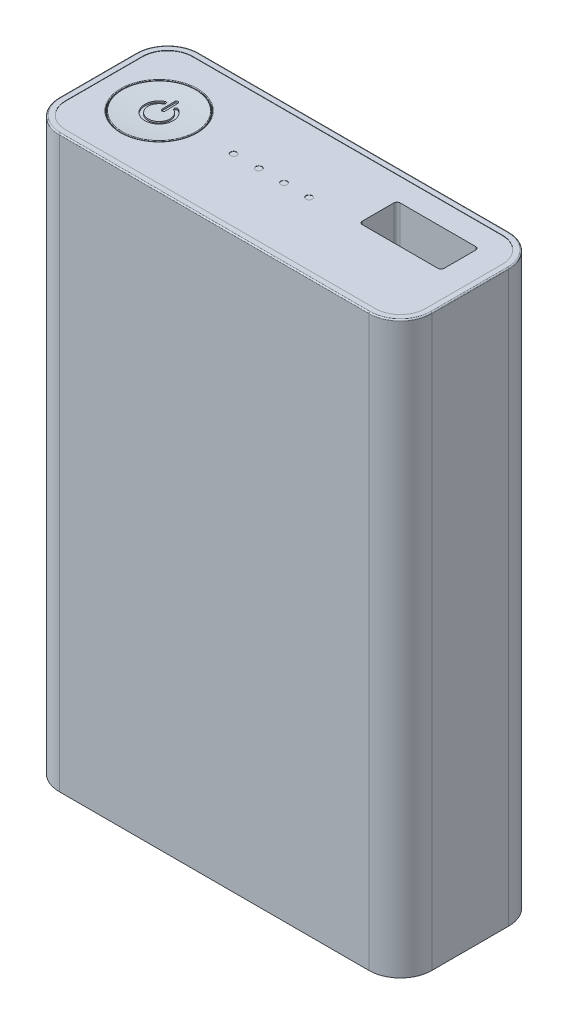
from build123d import *

# Parameters (mm, degrees)
SKETCH1_W      = 59.2
SKETCH1_H      = 22.2
EXTRUDE1_DEPTH = 90.6
FILLET1_R      = 5
EXTRUDE2_DEPTH = 0.05
SKETCH3_R      = 6
EXTRUDE3_DEPTH = 10
SKETCH4_R      = 5.9
EXTRUDE4_DEPTH = 10
FILLET2_R      = 0.1
FILLET3_R      = 0.1
SKETCH6_R      = 0.5
EXTRUDE5_DEPTH = 0.05
EXTRUDE8_DEPTH = 0.5
FILLET4_R      = 0.2
SKETCH8_W      = 13
SKETCH8_H      = 6
EXTRUDE9_DEPTH = 10
FILLET5_R      = 0.5


with BuildPart() as part:
    # Sketch1 → Extrude1 (new body)
    with BuildSketch(Plane(origin=(0, 0, 0), x_dir=(1, 0, 0), z_dir=(0, 1, 0))):
        Rectangle(SKETCH1_W, SKETCH1_H)
    extrude(amount=EXTRUDE1_DEPTH)

    # Fillet1
    fillet1_edges = [part.edges().sort_by_distance(p)[0] for p in [
        (29.6, 45.3, 11.1),
        (-29.6, 45.3, 11.1),
        (-29.6, 45.3, -11.1),
        (29.6, 45.3, -11.1),
    ]]
    fillet(fillet1_edges, radius=FILLET1_R)

    # Sketch2 → Extrude2 (cut)
    with BuildSketch(Plane(origin=(0, 90.6, 0), x_dir=(1, 0, 0), z_dir=(0, 1, 0))):
        with BuildLine():
            Line((-28.6, 6.1), (-28.6, -6.1))
            ThreePointArc((-28.6, -6.1), (-27.428427125, -8.928427125), (-24.6, -10.1))
            Line((-24.6, -10.1), (24.6, -10.1))
            ThreePointArc((24.6, -10.1), (27.428427125, -8.928427125), (28.6, -6.1))
            Line((28.6, -6.1), (28.6, 6.1))
            ThreePointArc((28.6, 6.1), (27.428427125, 8.928427125), (24.6, 10.1))
            Line((24.6, 10.1), (-24.6, 10.1))
            ThreePointArc((-24.6, 10.1), (-27.428427125, 8.928427125), (-28.6, 6.1))
        make_face()
    extrude(amount=-EXTRUDE2_DEPTH, mode=Mode.SUBTRACT)

    # Sketch3 → Extrude3 (cut)
    with BuildSketch(Plane(origin=(0, 90.55, 0), x_dir=(1, 0, 0), z_dir=(0, 1, 0))):
        with Locations(Location((-19.853967115, 0, 0), (0, 0, 270))):
            Circle(SKETCH3_R)
    extrude(amount=-EXTRUDE3_DEPTH, mode=Mode.SUBTRACT)

    # Fillet3
    fillet3_edges = [part.edges().sort_by_distance(p)[0] for p in [
        (-19.853967115, 90.55, -6),
    ]]
    fillet(fillet3_edges, radius=FILLET3_R)

    # Sketch6 → Extrude5 (cut)
    with BuildSketch(Plane(origin=(0, 90.55, 0), x_dir=(1, 0, 0), z_dir=(0, 1, 0))):
        with Locations(Location((-8, 0, 0), (0, 0, 270))):
            Circle(SKETCH6_R)
        with Locations(Location((-4, 0, 0), (0, 0, 270))):
            Circle(SKETCH6_R)
        with Locations(Location((0, 0, 0), (0, 0, 270))):
            Circle(SKETCH6_R)
        with Locations(Location((4, 0, 0), (0, 0, 270))):
            Circle(SKETCH6_R)
    extrude(amount=-EXTRUDE5_DEPTH, mode=Mode.SUBTRACT)

    # Fillet4
    fillet4_edges = [part.edges().sort_by_distance(p)[0] for p in [
        (0, 90.6, 11.1),
        (-29.6, 90.6, 0),
        (29.6, 90.6, 0),
        (0, 90.6, -11.1),
        (28.135533906, 90.6, 9.635533906),
        (28.135533906, 90.6, -9.635533906),
        (-28.135533906, 90.6, -9.635533906),
        (-28.135533906, 90.6, 9.635533906),
    ]]
    fillet(fillet4_edges, radius=FILLET4_R)

    # Sketch8 → Extrude9 (cut)
    with BuildSketch(Plane(origin=(0, 90.55, 0), x_dir=(1, 0, 0), z_dir=(0, 1, 0))):
        with Locations((17.986901839, 3.464293514)):
            Rectangle(SKETCH8_W, SKETCH8_H)
    extrude(amount=-EXTRUDE9_DEPTH, mode=Mode.SUBTRACT)

    # Fillet5
    fillet5_edges = [part.edges().sort_by_distance(p)[0] for p in [
        (11.486901839, 85.55, -0.464293514),
        (11.486901839, 85.55, -6.464293514),
        (24.486901839, 85.55, -6.464293514),
        (24.486901839, 85.55, -0.464293514),
    ]]
    fillet(fillet5_edges, radius=FILLET5_R)


with BuildPart() as body_2:
    # Sketch4 → Extrude4 (new body)
    with BuildSketch(Plane(origin=(0, 80.55, 0), x_dir=(1, 0, 0), z_dir=(0, 1, 0))):
        with Locations(Location((-19.853967115, 0, 0), (0, 0, 270))):
            Circle(SKETCH4_R)
    extrude(amount=EXTRUDE4_DEPTH)

    # Sketch5 → Cut-Revolve1 (revolve, cut)
    with BuildSketch(Plane.XY, mode=Mode.PRIVATE) as cut_revolve1_sk:
        with BuildLine():
            Line((-25.753967115, 90.55), (-19.853967115, 90.55))
            Line((-19.853967115, 90.55), (-19.853967115, 90.268787223))
            ThreePointArc((-19.853967115, 90.268787223), (-22.807316088, 90.3391303), (-25.753967115, 90.55))
        make_face()
    revolve(cut_revolve1_sk.sketch.rotate(Axis((-19.853967115, 80.55, 0), (0, 1, 0)), 270), axis=Axis((-19.853967115, 80.55, 0), (0, 1, 0)), mode=Mode.SUBTRACT)

    # Fillet2
    fillet2_edges = [body_2.edges().sort_by_distance(p)[0] for p in [
        (-25.753967115, 90.55, 0),
    ]]
    fillet(fillet2_edges, radius=FILLET2_R)

    # Sketch7 → Extrude8 (cut)
    with BuildSketch(Plane(origin=(0, 90.55, 0), x_dir=(1, 0, 0), z_dir=(0, 1, 0))):
        with BuildLine():
            Line((-20.113967115, 0.718981633), (-20.113967115, 2.723866666))
            ThreePointArc((-20.113967115, 2.723866666), (-19.853967115, 2.983866666), (-19.593967115, 2.723866666))
            Line((-19.593967115, 2.723866666), (-19.593967115, 0.718981633))
            ThreePointArc((-19.593967115, 0.718981633), (-19.853967115, 0.458981633), (-20.113967115, 0.718981633))
        make_face()
        with BuildLine():
            ThreePointArc((-20.935149799, 1.984601724), (-19.806891698, -2.25950966), (-18.856382539, 2.02791149))
            ThreePointArc((-18.856382539, 2.02791149), (-19.204448458, 1.909378306), (-19.085915273, 1.561312386))
            ThreePointArc((-19.085915273, 1.561312386), (-19.81772321, -1.739622482), (-20.686382102, 1.527967699))
            ThreePointArc((-20.686382102, 1.527967699), (-20.582448938, 1.88066856), (-20.935149799, 1.984601724))
        make_face()
    extrude(amount=-EXTRUDE8_DEPTH, mode=Mode.SUBTRACT)


solid = Compound([part.part, body_2.part])
